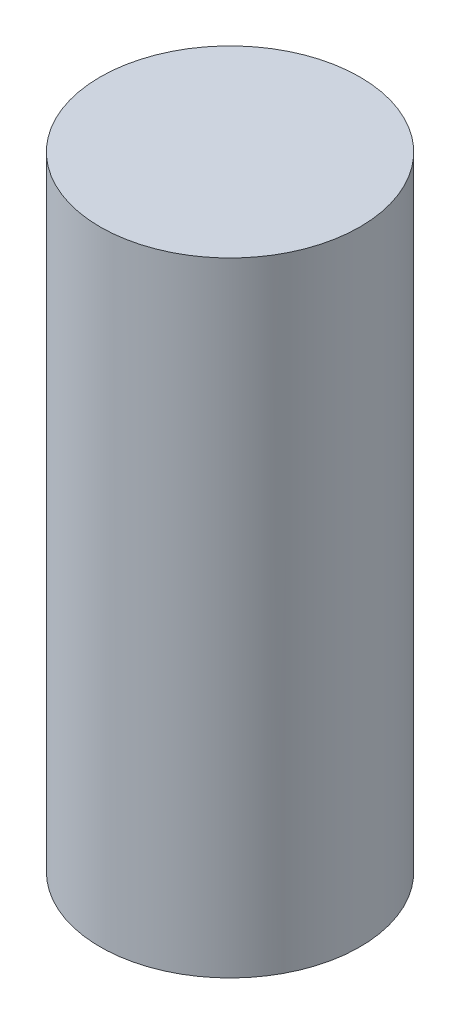
from build123d import *

# Parameters (mm, degrees)
BOSS_EXTRUDE1_DEPTH = 40
SKETCH2_R           = 15
BOSS_EXTRUDE2_DEPTH = 12
BOSS_EXTRUDE3_START = 20
SKETCH3_R           = 15
BOSS_EXTRUDE3_DEPTH = 20


with BuildPart() as part:
    # Sketch1 → Boss-Extrude1 (new body)
    with BuildSketch(Plane(origin=(0, 0, 0), x_dir=(1, 0, 0), z_dir=(0, 1, 0))):
        with BuildLine():
            Line((-4, 11), (4, 11))
            Line((4, 11), (4, 14.456832295))
            ThreePointArc((4, 14.456832295), (0, -15), (-4, 14.456832295))
            Line((-4, 14.456832295), (-4, 11))
        make_face()
    extrude(amount=BOSS_EXTRUDE1_DEPTH)

    # Sketch2 → Boss-Extrude2 (add)
    with BuildSketch(Plane(origin=(0, 40, 0), x_dir=(1, 0, 0), z_dir=(0, 1, 0))):
        with Locations(Location((0, 0, 0), (0, 0, 74.533990047))):
            Circle(SKETCH2_R)
    extrude(amount=BOSS_EXTRUDE2_DEPTH)

    # Sketch3 → Boss-Extrude3 (add)
    with BuildSketch(Plane.XZ.offset(BOSS_EXTRUDE3_START)):
        with Locations(Location((0, 0, 0), (0, 0, 270))):
            Circle(SKETCH3_R)
    extrude(amount=-BOSS_EXTRUDE3_DEPTH)


solid = part.part
